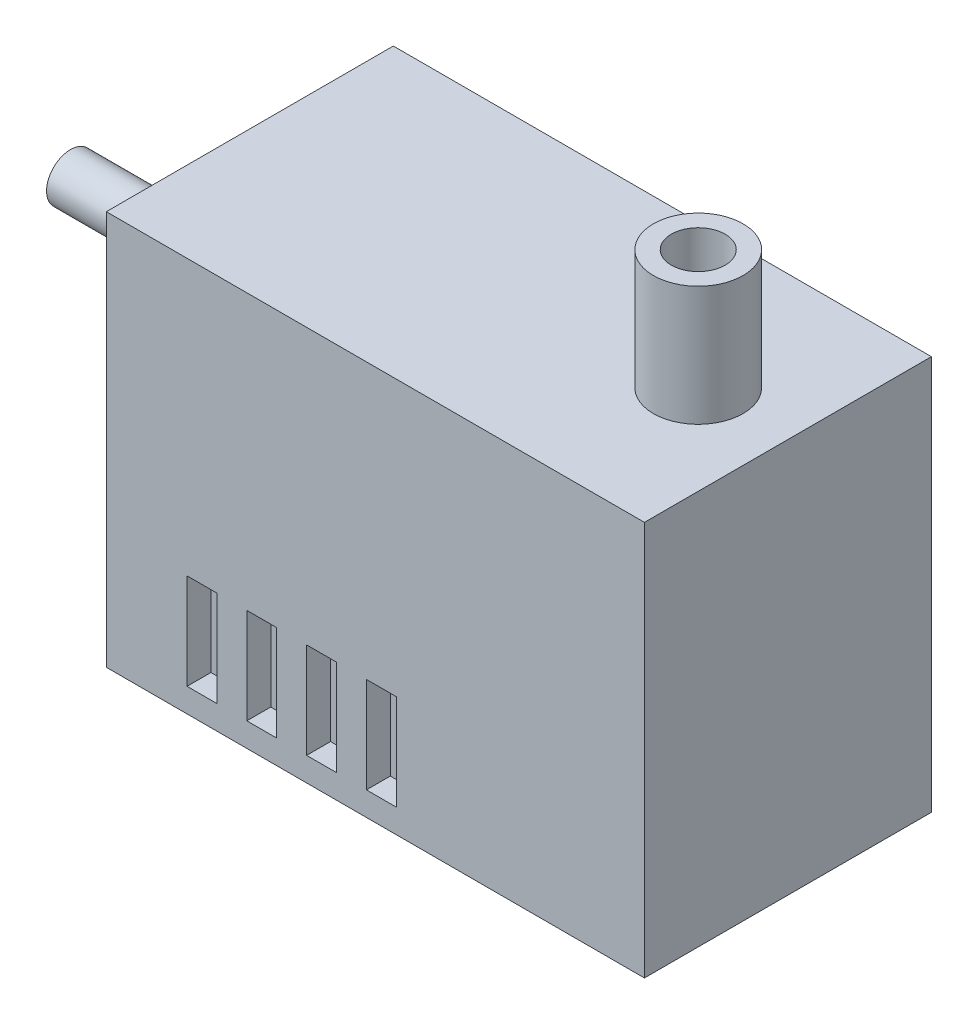
from build123d import *

# Parameters (mm, degrees)
SKETCH1_W         = 45
SKETCH1_H         = 24
PUMP_BODY_DEPTH   = 33
OUTLET_START      = 33
SKETCH2_R         = 3.75
OUTLET_DEPTH      = 10
OUTLET_BORE_START = 43
SKETCH3_R         = 2.25
OUTLET_BORE_DEPTH = 15
INLET_SLOTS_START = 12
SKETCH4_W         = 2.5
SKETCH4_H         = 8
INLET_SLOTS_DEPTH = 2
CABLE_STUB_START  = -37.5
SKETCH5_R         = 2
CABLE_STUB_DEPTH  = 15


with BuildPart() as part:
    # Sketch1 → Pump_Body (new body)
    with BuildSketch(Plane(origin=(0, 0, 0), x_dir=(1, 0, 0), z_dir=(0, 1, 0))):
        Rectangle(SKETCH1_W, SKETCH1_H)
    extrude(amount=PUMP_BODY_DEPTH)

    # Sketch2 → Outlet (add)
    with BuildSketch(Plane(origin=(0, 0, 0), x_dir=(1, 0, 0), z_dir=(0, 1, 0)).offset(OUTLET_START)):
        with Locations(Location((15, 0, 0), (0, 0, 270))):
            Circle(SKETCH2_R)
    extrude(amount=OUTLET_DEPTH)

    # Sketch3 → Outlet_Bore (cut)
    with BuildSketch(Plane(origin=(0, 0, 0), x_dir=(1, 0, 0), z_dir=(0, 1, 0)).offset(OUTLET_BORE_START)):
        with Locations(Location((15, 0, 0), (0, 0, 270))):
            Circle(SKETCH3_R)
    extrude(amount=-OUTLET_BORE_DEPTH, mode=Mode.SUBTRACT)

    # Sketch4 → Inlet_Slots (cut)
    with BuildSketch(Plane.XY.offset(INLET_SLOTS_START)):
        with Locations((-14.5, 6)):
            Rectangle(SKETCH4_W, SKETCH4_H)
        with Locations((-9.5, 6)):
            Rectangle(SKETCH4_W, SKETCH4_H)
        with Locations((-4.5, 6)):
            Rectangle(SKETCH4_W, SKETCH4_H)
        with Locations((0.5, 6)):
            Rectangle(SKETCH4_W, SKETCH4_H)
    extrude(amount=-INLET_SLOTS_DEPTH, mode=Mode.SUBTRACT)

    # Sketch5 → Cable_Stub (add)
    with BuildSketch(Plane(origin=(0, 0, 0), x_dir=(0, 0, -1), z_dir=(1, 0, 0)).offset(CABLE_STUB_START)):
        with Locations((0, 22)):
            Circle(SKETCH5_R)
    extrude(amount=CABLE_STUB_DEPTH)


solid = part.part
